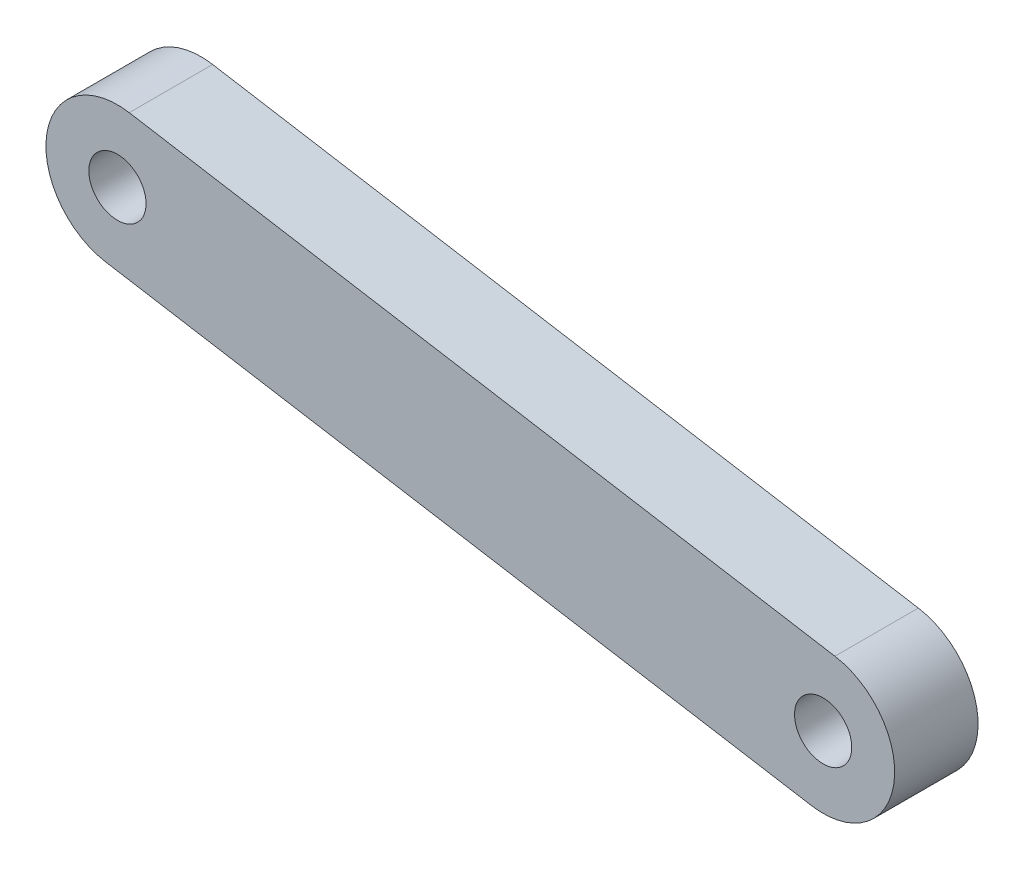
from build123d import *

# Parameters (mm, degrees)
SKETCH17_R           = 120
BOSS_EXTRUDE12_DEPTH = 350


with BuildPart() as part:
    # Sketch17 → Boss-Extrude12 (new body)
    with BuildSketch(Plane.XY):
        with BuildLine():
            Line((1718.647386789, -653.378187074), (4679.042696174, -1148.02651725))
            ThreePointArc((4679.042696174, -1148.02651725), (4925.4994331, -1493.365592396), (4580.160357954, -1739.822329323))
            Line((4580.160357954, -1739.822329323), (1619.765048569, -1245.173999148))
            ThreePointArc((1619.765048569, -1245.173999148), (1373.308311642, -899.834924001), (1718.647386789, -653.378187074))
        make_face()
        with Locations((4629.601527064, -1443.924423286)):
            Circle(SKETCH17_R, mode=Mode.SUBTRACT)
        with Locations((1669.206217679, -949.276093111)):
            Circle(SKETCH17_R, mode=Mode.SUBTRACT)
    extrude(amount=BOSS_EXTRUDE12_DEPTH)


solid = part.part
